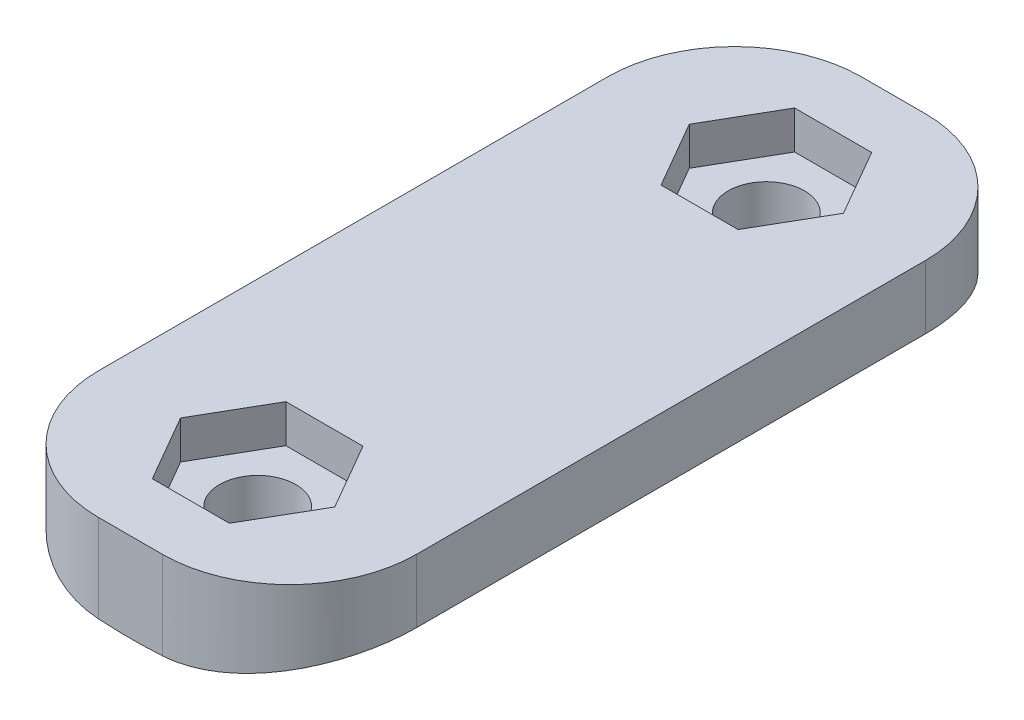
from build123d import *

# Parameters (mm, degrees)
EXTRUDE_1_DEPTH          = 60
CUT_EXTRUDE_1_REACH      = 63.686
CUT_EXTRUDE_1_END_RADIUS = 40.2
SKETCH_2_R               = 3
CUT_EXTRUDE_2_DEPTH      = 3
FILLET_1_R               = 10


with BuildPart() as part:
    # Эскиз1 → Бобышка-Вытянуть1 (new body)
    with BuildSketch(Plane.XY):
        with BuildLine():
            Line((-12.5, -38.207198275), (-12.5, -33.207198275))
            Line((-12.5, -33.207198275), (12.5, -33.207198275))
            Line((12.5, -33.207198275), (12.5, -38.207198275))
            ThreePointArc((12.5, -38.207198275), (0, -40.2), (-12.5, -38.207198275))
        make_face()
    extrude(amount=EXTRUDE_1_DEPTH)

    # Вырез-Вытянуть1: up to this cylinder (the profile starts inside it)
    cut_extrude_1_end = Plane(origin=(0, 0, 30), z_dir=(0, 0, -1)) * Cylinder(CUT_EXTRUDE_1_END_RADIUS, 248.772, mode=Mode.PRIVATE)
    # Эскиз2 → Вырез-Вытянуть1 (cut, up to the surface)
    with BuildSketch(Plane(origin=(0, -33.207198275, 0), x_dir=(1, 0, 0), z_dir=(0, 1, 0)), mode=Mode.PRIVATE) as cut_extrude_1_sk1:
        with Locations(Location((0, -10, 0), (0, 0, 270))):
            Circle(SKETCH_2_R)
    cut_extrude_1_tool1 = extrude(cut_extrude_1_sk1.sketch, amount=-CUT_EXTRUDE_1_REACH, mode=Mode.PRIVATE) & cut_extrude_1_end
    add(cut_extrude_1_tool1.solids().sort_by_distance((0, -33.207198, 10))[0], mode=Mode.SUBTRACT)
    # Эскиз2 → Вырез-Вытянуть1 (cut, up to the surface)
    with BuildSketch(Plane(origin=(0, -33.207198275, 0), x_dir=(1, 0, 0), z_dir=(0, 1, 0)), mode=Mode.PRIVATE) as cut_extrude_1_sk2:
        with Locations(Location((0, -50, 0), (0, 0, 270))):
            Circle(SKETCH_2_R)
    cut_extrude_1_tool2 = extrude(cut_extrude_1_sk2.sketch, amount=-CUT_EXTRUDE_1_REACH, mode=Mode.PRIVATE) & cut_extrude_1_end
    add(cut_extrude_1_tool2.solids().sort_by_distance((0, -33.207198, 50))[0], mode=Mode.SUBTRACT)

    # Эскиз3 → Вырез-Вытянуть2 (cut)
    with BuildSketch(Plane(origin=(0, -33.207198275, 0), x_dir=(1, 0, 0), z_dir=(0, 1, 0))):
        Polygon((3.031088913, -4.75), (-3.031088913, -4.75), (-6.062177826, -10), (-3.031088913, -15.25), (3.031088913, -15.25), (6.062177826, -10), align=None)
        Polygon((3.031088913, -44.75), (-3.031088913, -44.75), (-6.062177826, -50), (-3.031088913, -55.25), (3.031088913, -55.25), (6.062177826, -50), align=None)
    extrude(amount=-CUT_EXTRUDE_2_DEPTH, mode=Mode.SUBTRACT)

    # Скругление1
    fillet_1_edges = [part.edges().sort_by_distance(p)[0] for p in [
        (-12.5, -35.707198275, 60),
        (-12.5, -35.707198275, 0),
        (12.5, -35.707198275, 0),
        (12.5, -35.707198275, 60),
    ]]
    fillet(fillet_1_edges, radius=FILLET_1_R)


solid = part.part
